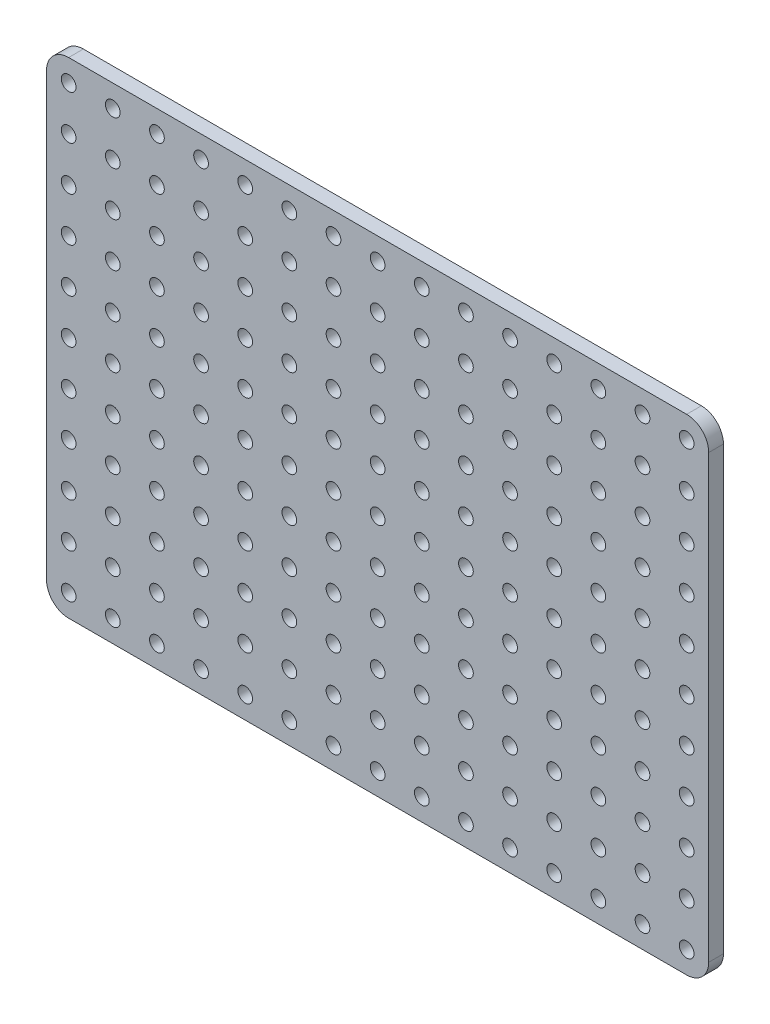
from build123d import *

# Parameters (mm, degrees)
MODEL_R                 = 1.5
SALIENTE_EXTRUIR1_DEPTH = 3


with BuildPart() as part:
    # Model → Saliente-Extruir1 (new body)
    with BuildSketch(Plane.XY):
        with BuildLine():
            Line((391.429131311, 489.742243614), (517.429131311, 489.742243614))
            ThreePointArc((517.429131311, 489.742243614), (520.611111826, 488.424224129), (521.929131311, 485.242243614))
            Line((521.929131311, 485.242243614), (521.929131311, 395.242243614))
            ThreePointArc((521.929131311, 395.242243614), (520.611111826, 392.060263099), (517.429131311, 390.742243614))
            Line((517.429131311, 390.742243614), (391.429131311, 390.742243614))
            ThreePointArc((391.429131311, 390.742243614), (388.247150795, 392.060263099), (386.929131311, 395.242243614))
            Line((386.929131311, 395.242243614), (386.929131311, 485.242243614))
            ThreePointArc((386.929131311, 485.242243614), (388.247150795, 488.424224129), (391.429131311, 489.742243614))
        make_face()
        with Locations((391.429131311, 485.242243614)):
            Circle(MODEL_R, mode=Mode.SUBTRACT)
        with Locations((391.429131311, 476.242243614)):
            Circle(MODEL_R, mode=Mode.SUBTRACT)
        with Locations((391.429131311, 467.242243614)):
            Circle(MODEL_R, mode=Mode.SUBTRACT)
        with Locations((391.429131311, 458.242243614)):
            Circle(MODEL_R, mode=Mode.SUBTRACT)
        with Locations((391.429131311, 449.242243614)):
            Circle(MODEL_R, mode=Mode.SUBTRACT)
        with Locations((391.429131311, 440.242243614)):
            Circle(MODEL_R, mode=Mode.SUBTRACT)
        with Locations((391.429131311, 431.242243614)):
            Circle(MODEL_R, mode=Mode.SUBTRACT)
        with Locations((391.429131311, 422.242243614)):
            Circle(MODEL_R, mode=Mode.SUBTRACT)
        with Locations((391.429131311, 413.242243614)):
            Circle(MODEL_R, mode=Mode.SUBTRACT)
        with Locations((391.429131311, 404.242243614)):
            Circle(MODEL_R, mode=Mode.SUBTRACT)
        with Locations((391.429131311, 395.242243614)):
            Circle(MODEL_R, mode=Mode.SUBTRACT)
        with Locations((400.429131311, 485.242243614)):
            Circle(MODEL_R, mode=Mode.SUBTRACT)
        with Locations((400.429131311, 476.242243614)):
            Circle(MODEL_R, mode=Mode.SUBTRACT)
        with Locations((400.429131311, 467.242243614)):
            Circle(MODEL_R, mode=Mode.SUBTRACT)
        with Locations((400.429131311, 458.242243614)):
            Circle(MODEL_R, mode=Mode.SUBTRACT)
        with Locations((400.429131311, 449.242243614)):
            Circle(MODEL_R, mode=Mode.SUBTRACT)
        with Locations((400.429131311, 440.242243614)):
            Circle(MODEL_R, mode=Mode.SUBTRACT)
        with Locations((400.429131311, 431.242243614)):
            Circle(MODEL_R, mode=Mode.SUBTRACT)
        with Locations((400.429131311, 422.242243614)):
            Circle(MODEL_R, mode=Mode.SUBTRACT)
        with Locations((400.429131311, 413.242243614)):
            Circle(MODEL_R, mode=Mode.SUBTRACT)
        with Locations((400.429131311, 404.242243614)):
            Circle(MODEL_R, mode=Mode.SUBTRACT)
        with Locations((400.429131311, 395.242243614)):
            Circle(MODEL_R, mode=Mode.SUBTRACT)
        with Locations((409.429131311, 485.242243614)):
            Circle(MODEL_R, mode=Mode.SUBTRACT)
        with Locations((409.429131311, 476.242243614)):
            Circle(MODEL_R, mode=Mode.SUBTRACT)
        with Locations((409.429131311, 467.242243614)):
            Circle(MODEL_R, mode=Mode.SUBTRACT)
        with Locations((409.429131311, 458.242243614)):
            Circle(MODEL_R, mode=Mode.SUBTRACT)
        with Locations((409.429131311, 449.242243614)):
            Circle(MODEL_R, mode=Mode.SUBTRACT)
        with Locations((409.429131311, 440.242243614)):
            Circle(MODEL_R, mode=Mode.SUBTRACT)
        with Locations((409.429131311, 431.242243614)):
            Circle(MODEL_R, mode=Mode.SUBTRACT)
        with Locations((409.429131311, 422.242243614)):
            Circle(MODEL_R, mode=Mode.SUBTRACT)
        with Locations((409.429131311, 413.242243614)):
            Circle(MODEL_R, mode=Mode.SUBTRACT)
        with Locations((409.429131311, 404.242243614)):
            Circle(MODEL_R, mode=Mode.SUBTRACT)
        with Locations((409.429131311, 395.242243614)):
            Circle(MODEL_R, mode=Mode.SUBTRACT)
        with Locations((418.429131311, 485.242243614)):
            Circle(MODEL_R, mode=Mode.SUBTRACT)
        with Locations((418.429131311, 476.242243614)):
            Circle(MODEL_R, mode=Mode.SUBTRACT)
        with Locations((418.429131311, 467.242243614)):
            Circle(MODEL_R, mode=Mode.SUBTRACT)
        with Locations((418.429131311, 458.242243614)):
            Circle(MODEL_R, mode=Mode.SUBTRACT)
        with Locations((418.429131311, 449.242243614)):
            Circle(MODEL_R, mode=Mode.SUBTRACT)
        with Locations((418.429131311, 440.242243614)):
            Circle(MODEL_R, mode=Mode.SUBTRACT)
        with Locations((418.429131311, 431.242243614)):
            Circle(MODEL_R, mode=Mode.SUBTRACT)
        with Locations((418.429131311, 422.242243614)):
            Circle(MODEL_R, mode=Mode.SUBTRACT)
        with Locations((418.429131311, 413.242243614)):
            Circle(MODEL_R, mode=Mode.SUBTRACT)
        with Locations((418.429131311, 404.242243614)):
            Circle(MODEL_R, mode=Mode.SUBTRACT)
        with Locations((418.429131311, 395.242243614)):
            Circle(MODEL_R, mode=Mode.SUBTRACT)
        with Locations((427.429131311, 485.242243614)):
            Circle(MODEL_R, mode=Mode.SUBTRACT)
        with Locations((427.429131311, 476.242243614)):
            Circle(MODEL_R, mode=Mode.SUBTRACT)
        with Locations((427.429131311, 467.242243614)):
            Circle(MODEL_R, mode=Mode.SUBTRACT)
        with Locations((427.429131311, 458.242243614)):
            Circle(MODEL_R, mode=Mode.SUBTRACT)
        with Locations((427.429131311, 449.242243614)):
            Circle(MODEL_R, mode=Mode.SUBTRACT)
        with Locations((427.429131311, 440.242243614)):
            Circle(MODEL_R, mode=Mode.SUBTRACT)
        with Locations((427.429131311, 431.242243614)):
            Circle(MODEL_R, mode=Mode.SUBTRACT)
        with Locations((427.429131311, 422.242243614)):
            Circle(MODEL_R, mode=Mode.SUBTRACT)
        with Locations((427.429131311, 413.242243614)):
            Circle(MODEL_R, mode=Mode.SUBTRACT)
        with Locations((427.429131311, 404.242243614)):
            Circle(MODEL_R, mode=Mode.SUBTRACT)
        with Locations((427.429131311, 395.242243614)):
            Circle(MODEL_R, mode=Mode.SUBTRACT)
        with Locations((436.429131311, 485.242243614)):
            Circle(MODEL_R, mode=Mode.SUBTRACT)
        with Locations((436.429131311, 476.242243614)):
            Circle(MODEL_R, mode=Mode.SUBTRACT)
        with Locations((436.429131311, 467.242243614)):
            Circle(MODEL_R, mode=Mode.SUBTRACT)
        with Locations((436.429131311, 458.242243614)):
            Circle(MODEL_R, mode=Mode.SUBTRACT)
        with Locations((436.429131311, 449.242243614)):
            Circle(MODEL_R, mode=Mode.SUBTRACT)
        with Locations((436.429131311, 440.242243614)):
            Circle(MODEL_R, mode=Mode.SUBTRACT)
        with Locations((436.429131311, 431.242243614)):
            Circle(MODEL_R, mode=Mode.SUBTRACT)
        with Locations((436.429131311, 422.242243614)):
            Circle(MODEL_R, mode=Mode.SUBTRACT)
        with Locations((436.429131311, 413.242243614)):
            Circle(MODEL_R, mode=Mode.SUBTRACT)
        with Locations((436.429131311, 404.242243614)):
            Circle(MODEL_R, mode=Mode.SUBTRACT)
        with Locations((436.429131311, 395.242243614)):
            Circle(MODEL_R, mode=Mode.SUBTRACT)
        with Locations((445.429131311, 485.242243614)):
            Circle(MODEL_R, mode=Mode.SUBTRACT)
        with Locations((445.429131311, 476.242243614)):
            Circle(MODEL_R, mode=Mode.SUBTRACT)
        with Locations((445.429131311, 467.242243614)):
            Circle(MODEL_R, mode=Mode.SUBTRACT)
        with Locations((445.429131311, 458.242243614)):
            Circle(MODEL_R, mode=Mode.SUBTRACT)
        with Locations((445.429131311, 449.242243614)):
            Circle(MODEL_R, mode=Mode.SUBTRACT)
        with Locations((445.429131311, 440.242243614)):
            Circle(MODEL_R, mode=Mode.SUBTRACT)
        with Locations((445.429131311, 431.242243614)):
            Circle(MODEL_R, mode=Mode.SUBTRACT)
        with Locations((445.429131311, 422.242243614)):
            Circle(MODEL_R, mode=Mode.SUBTRACT)
        with Locations((445.429131311, 413.242243614)):
            Circle(MODEL_R, mode=Mode.SUBTRACT)
        with Locations((445.429131311, 404.242243614)):
            Circle(MODEL_R, mode=Mode.SUBTRACT)
        with Locations((445.429131311, 395.242243614)):
            Circle(MODEL_R, mode=Mode.SUBTRACT)
        with Locations((454.429131311, 485.242243614)):
            Circle(MODEL_R, mode=Mode.SUBTRACT)
        with Locations((454.429131311, 476.242243614)):
            Circle(MODEL_R, mode=Mode.SUBTRACT)
        with Locations((454.429131311, 467.242243614)):
            Circle(MODEL_R, mode=Mode.SUBTRACT)
        with Locations((454.429131311, 458.242243614)):
            Circle(MODEL_R, mode=Mode.SUBTRACT)
        with Locations((454.429131311, 449.242243614)):
            Circle(MODEL_R, mode=Mode.SUBTRACT)
        with Locations((454.429131311, 440.242243614)):
            Circle(MODEL_R, mode=Mode.SUBTRACT)
        with Locations((454.429131311, 431.242243614)):
            Circle(MODEL_R, mode=Mode.SUBTRACT)
        with Locations((454.429131311, 422.242243614)):
            Circle(MODEL_R, mode=Mode.SUBTRACT)
        with Locations((454.429131311, 413.242243614)):
            Circle(MODEL_R, mode=Mode.SUBTRACT)
        with Locations((454.429131311, 404.242243614)):
            Circle(MODEL_R, mode=Mode.SUBTRACT)
        with Locations((454.429131311, 395.242243614)):
            Circle(MODEL_R, mode=Mode.SUBTRACT)
        with Locations((463.429131311, 485.242243614)):
            Circle(MODEL_R, mode=Mode.SUBTRACT)
        with Locations((463.429131311, 476.242243614)):
            Circle(MODEL_R, mode=Mode.SUBTRACT)
        with Locations((463.429131311, 467.242243614)):
            Circle(MODEL_R, mode=Mode.SUBTRACT)
        with Locations((463.429131311, 458.242243614)):
            Circle(MODEL_R, mode=Mode.SUBTRACT)
        with Locations((463.429131311, 449.242243614)):
            Circle(MODEL_R, mode=Mode.SUBTRACT)
        with Locations((463.429131311, 440.242243614)):
            Circle(MODEL_R, mode=Mode.SUBTRACT)
        with Locations((463.429131311, 431.242243614)):
            Circle(MODEL_R, mode=Mode.SUBTRACT)
        with Locations((463.429131311, 422.242243614)):
            Circle(MODEL_R, mode=Mode.SUBTRACT)
        with Locations((463.429131311, 413.242243614)):
            Circle(MODEL_R, mode=Mode.SUBTRACT)
        with Locations((463.429131311, 404.242243614)):
            Circle(MODEL_R, mode=Mode.SUBTRACT)
        with Locations((463.429131311, 395.242243614)):
            Circle(MODEL_R, mode=Mode.SUBTRACT)
        with Locations((472.429131311, 485.242243614)):
            Circle(MODEL_R, mode=Mode.SUBTRACT)
        with Locations((472.429131311, 476.242243614)):
            Circle(MODEL_R, mode=Mode.SUBTRACT)
        with Locations((472.429131311, 467.242243614)):
            Circle(MODEL_R, mode=Mode.SUBTRACT)
        with Locations((472.429131311, 458.242243614)):
            Circle(MODEL_R, mode=Mode.SUBTRACT)
        with Locations((472.429131311, 449.242243614)):
            Circle(MODEL_R, mode=Mode.SUBTRACT)
        with Locations((472.429131311, 440.242243614)):
            Circle(MODEL_R, mode=Mode.SUBTRACT)
        with Locations((472.429131311, 431.242243614)):
            Circle(MODEL_R, mode=Mode.SUBTRACT)
        with Locations((472.429131311, 422.242243614)):
            Circle(MODEL_R, mode=Mode.SUBTRACT)
        with Locations((472.429131311, 413.242243614)):
            Circle(MODEL_R, mode=Mode.SUBTRACT)
        with Locations((472.429131311, 404.242243614)):
            Circle(MODEL_R, mode=Mode.SUBTRACT)
        with Locations((472.429131311, 395.242243614)):
            Circle(MODEL_R, mode=Mode.SUBTRACT)
        with Locations((481.429131311, 485.242243614)):
            Circle(MODEL_R, mode=Mode.SUBTRACT)
        with Locations((481.429131311, 476.242243614)):
            Circle(MODEL_R, mode=Mode.SUBTRACT)
        with Locations((481.429131311, 467.242243614)):
            Circle(MODEL_R, mode=Mode.SUBTRACT)
        with Locations((481.429131311, 458.242243614)):
            Circle(MODEL_R, mode=Mode.SUBTRACT)
        with Locations((481.429131311, 449.242243614)):
            Circle(MODEL_R, mode=Mode.SUBTRACT)
        with Locations((481.429131311, 440.242243614)):
            Circle(MODEL_R, mode=Mode.SUBTRACT)
        with Locations((481.429131311, 431.242243614)):
            Circle(MODEL_R, mode=Mode.SUBTRACT)
        with Locations((481.429131311, 422.242243614)):
            Circle(MODEL_R, mode=Mode.SUBTRACT)
        with Locations((481.429131311, 413.242243614)):
            Circle(MODEL_R, mode=Mode.SUBTRACT)
        with Locations((481.429131311, 404.242243614)):
            Circle(MODEL_R, mode=Mode.SUBTRACT)
        with Locations((481.429131311, 395.242243614)):
            Circle(MODEL_R, mode=Mode.SUBTRACT)
        with Locations((490.429131311, 485.242243614)):
            Circle(MODEL_R, mode=Mode.SUBTRACT)
        with Locations((490.429131311, 476.242243614)):
            Circle(MODEL_R, mode=Mode.SUBTRACT)
        with Locations((490.429131311, 467.242243614)):
            Circle(MODEL_R, mode=Mode.SUBTRACT)
        with Locations((490.429131311, 458.242243614)):
            Circle(MODEL_R, mode=Mode.SUBTRACT)
        with Locations((490.429131311, 449.242243614)):
            Circle(MODEL_R, mode=Mode.SUBTRACT)
        with Locations((490.429131311, 440.242243614)):
            Circle(MODEL_R, mode=Mode.SUBTRACT)
        with Locations((490.429131311, 431.242243614)):
            Circle(MODEL_R, mode=Mode.SUBTRACT)
        with Locations((490.429131311, 422.242243614)):
            Circle(MODEL_R, mode=Mode.SUBTRACT)
        with Locations((490.429131311, 413.242243614)):
            Circle(MODEL_R, mode=Mode.SUBTRACT)
        with Locations((490.429131311, 404.242243614)):
            Circle(MODEL_R, mode=Mode.SUBTRACT)
        with Locations((490.429131311, 395.242243614)):
            Circle(MODEL_R, mode=Mode.SUBTRACT)
        with Locations((499.429131311, 485.242243614)):
            Circle(MODEL_R, mode=Mode.SUBTRACT)
        with Locations((499.429131311, 476.242243614)):
            Circle(MODEL_R, mode=Mode.SUBTRACT)
        with Locations((499.429131311, 467.242243614)):
            Circle(MODEL_R, mode=Mode.SUBTRACT)
        with Locations((499.429131311, 458.242243614)):
            Circle(MODEL_R, mode=Mode.SUBTRACT)
        with Locations((499.429131311, 449.242243614)):
            Circle(MODEL_R, mode=Mode.SUBTRACT)
        with Locations((499.429131311, 440.242243614)):
            Circle(MODEL_R, mode=Mode.SUBTRACT)
        with Locations((499.429131311, 431.242243614)):
            Circle(MODEL_R, mode=Mode.SUBTRACT)
        with Locations((499.429131311, 422.242243614)):
            Circle(MODEL_R, mode=Mode.SUBTRACT)
        with Locations((499.429131311, 413.242243614)):
            Circle(MODEL_R, mode=Mode.SUBTRACT)
        with Locations((499.429131311, 404.242243614)):
            Circle(MODEL_R, mode=Mode.SUBTRACT)
        with Locations((499.429131311, 395.242243614)):
            Circle(MODEL_R, mode=Mode.SUBTRACT)
        with Locations((508.429131311, 485.242243614)):
            Circle(MODEL_R, mode=Mode.SUBTRACT)
        with Locations((508.429131311, 476.242243614)):
            Circle(MODEL_R, mode=Mode.SUBTRACT)
        with Locations((508.429131311, 467.242243614)):
            Circle(MODEL_R, mode=Mode.SUBTRACT)
        with Locations((508.429131311, 458.242243614)):
            Circle(MODEL_R, mode=Mode.SUBTRACT)
        with Locations((508.429131311, 449.242243614)):
            Circle(MODEL_R, mode=Mode.SUBTRACT)
        with Locations((508.429131311, 440.242243614)):
            Circle(MODEL_R, mode=Mode.SUBTRACT)
        with Locations((508.429131311, 431.242243614)):
            Circle(MODEL_R, mode=Mode.SUBTRACT)
        with Locations((508.429131311, 422.242243614)):
            Circle(MODEL_R, mode=Mode.SUBTRACT)
        with Locations((508.429131311, 413.242243614)):
            Circle(MODEL_R, mode=Mode.SUBTRACT)
        with Locations((508.429131311, 404.242243614)):
            Circle(MODEL_R, mode=Mode.SUBTRACT)
        with Locations((508.429131311, 395.242243614)):
            Circle(MODEL_R, mode=Mode.SUBTRACT)
        with Locations((517.429131311, 485.242243614)):
            Circle(MODEL_R, mode=Mode.SUBTRACT)
        with Locations((517.429131311, 476.242243614)):
            Circle(MODEL_R, mode=Mode.SUBTRACT)
        with Locations((517.429131311, 467.242243614)):
            Circle(MODEL_R, mode=Mode.SUBTRACT)
        with Locations((517.429131311, 458.242243614)):
            Circle(MODEL_R, mode=Mode.SUBTRACT)
        with Locations((517.429131311, 449.242243614)):
            Circle(MODEL_R, mode=Mode.SUBTRACT)
        with Locations((517.429131311, 440.242243614)):
            Circle(MODEL_R, mode=Mode.SUBTRACT)
        with Locations((517.429131311, 431.242243614)):
            Circle(MODEL_R, mode=Mode.SUBTRACT)
        with Locations((517.429131311, 422.242243614)):
            Circle(MODEL_R, mode=Mode.SUBTRACT)
        with Locations((517.429131311, 413.242243614)):
            Circle(MODEL_R, mode=Mode.SUBTRACT)
        with Locations((517.429131311, 404.242243614)):
            Circle(MODEL_R, mode=Mode.SUBTRACT)
        with Locations((517.429131311, 395.242243614)):
            Circle(MODEL_R, mode=Mode.SUBTRACT)
    extrude(amount=SALIENTE_EXTRUIR1_DEPTH)


solid = part.part
